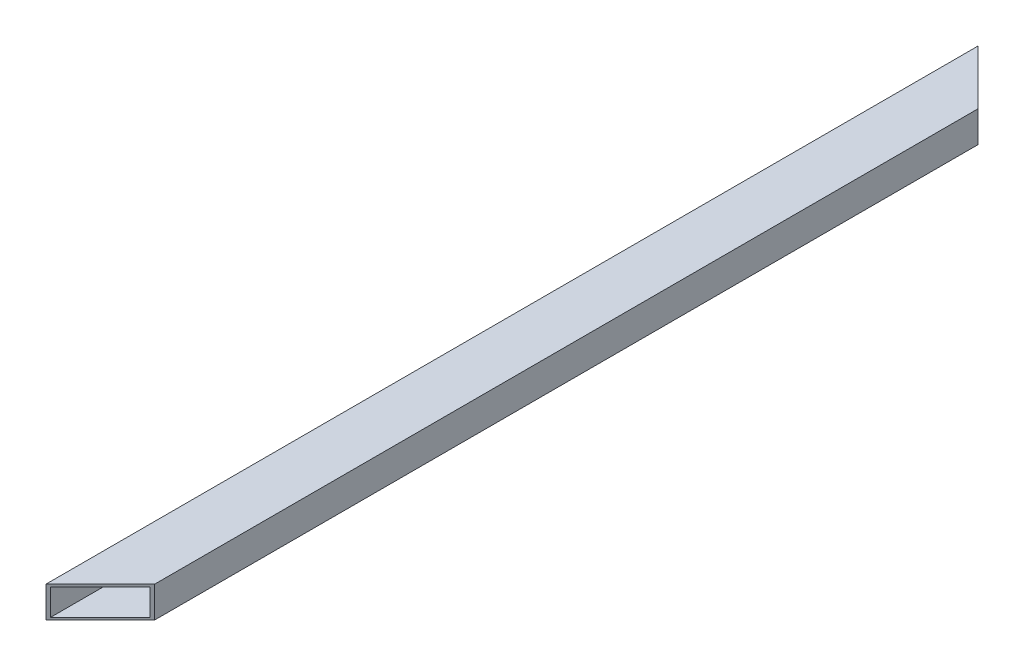
from build123d import *

# Parameters (mm, degrees)
ESQUISSE1_W             = 35
ESQUISSE1_H             = 20
ESQUISSE1_W_2           = 32
ESQUISSE1_H_2           = 17
BOSS_EXTRU_1_DEPTH      = 600
ENL_V_MAT_EXTRU_1_DEPTH = 602.352641966
ENL_V_MAT_EXTRU_3_DEPTH = 602.352641966


with BuildPart() as part:
    # Esquisse1 → Boss.-Extru.1 (new body)
    with BuildSketch(Plane.XY):
        with Locations((17.5, 10)):
            Rectangle(ESQUISSE1_W, ESQUISSE1_H)
        with Locations((17.5, 10)):
            Rectangle(ESQUISSE1_W_2, ESQUISSE1_H_2, mode=Mode.SUBTRACT)
    extrude(amount=BOSS_EXTRU_1_DEPTH)

    # Esquisse2 → Enlèv. mat.-Extru.1 (cut, through all)
    with BuildSketch(Plane(origin=(0, 0, 0), x_dir=(1, 0, 0), z_dir=(0, 1, 0))):
        Polygon((0, -600), (35, -565), (35, -600), align=None)
    extrude(amount=ENL_V_MAT_EXTRU_1_DEPTH, mode=Mode.SUBTRACT)

    # Esquisse4 → Enlèv. mat.-Extru.3 (cut, through all)
    with BuildSketch(Plane(origin=(0, 0, 0), x_dir=(1, 0, 0), z_dir=(0, 1, 0))):
        Polygon((0, 0), (35, -35), (35, 0), align=None)
    extrude(amount=ENL_V_MAT_EXTRU_3_DEPTH, mode=Mode.SUBTRACT)


solid = part.part
